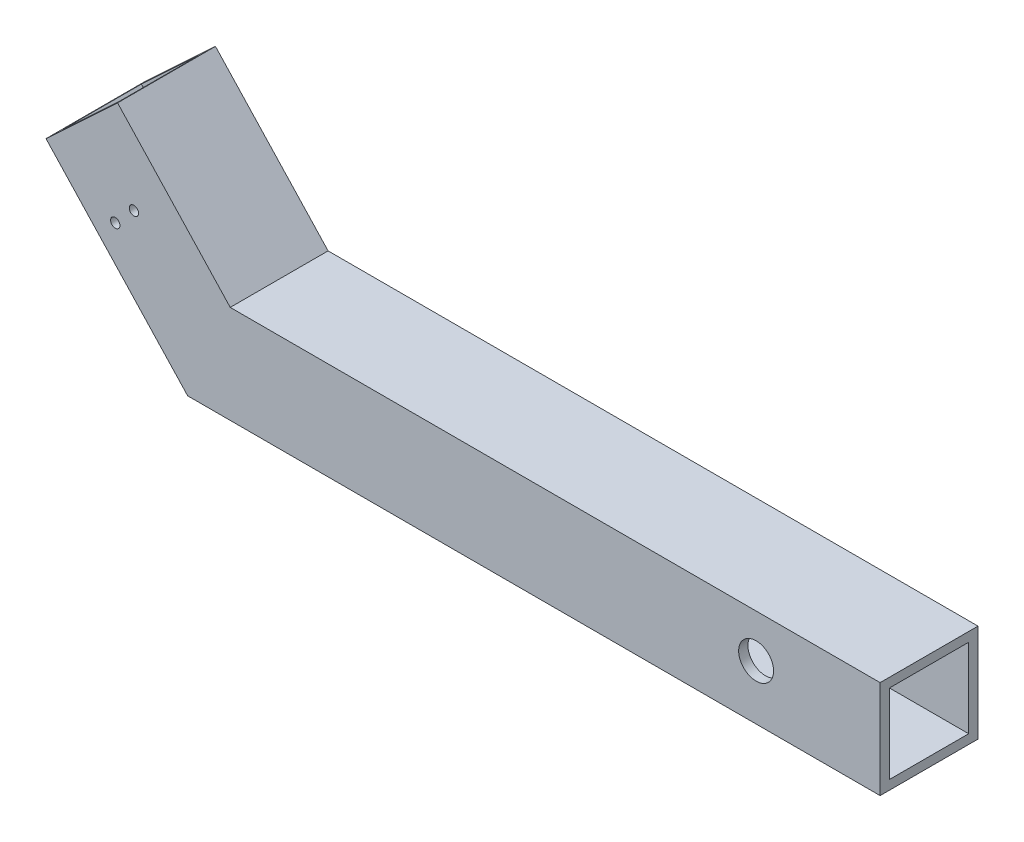
from build123d import *

# Parameters (mm, degrees)
SKETCH2_W          = 26.67
SKETCH2_H          = 26.67
SKETCH2_W_2        = 21.59
SKETCH2_H_2        = 21.59
SKETCH4_R          = 4.7625
CUT_EXTRUDE2_DEPTH = 234.463995003
SKETCH5_R          = 1.27
CUT_EXTRUDE3_DEPTH = 234.463995003


with BuildPart() as part:
    # Sweep1: sweep along a path in Sketch1
    with BuildLine(Plane.XY) as sweep1_path:
        Line((0, 0), (-171.835765676, 0))
        Line((-171.835765676, 0), (-182.88, 0))
        Line((-182.88, 0), (-190.412149697, 8.077241654))
        Line((-190.412149697, 8.077241654), (-217.525516691, 37.152768042))
    # Sketch2 → Sweep1 (sweep)
    with BuildSketch(Plane(origin=(0, 0, 0), x_dir=(0, 0, -1), z_dir=(1, 0, 0))):
        Rectangle(SKETCH2_W, SKETCH2_H)
        Rectangle(SKETCH2_W_2, SKETCH2_H_2, mode=Mode.SUBTRACT)
    sweep(path=sweep1_path.line, transition=Transition.RIGHT)

    # Sketch4 → Cut-Extrude2 (cut, through all)
    with BuildSketch(Plane.XY.offset(13.335)):
        with Locations((-33.788615372, 1.553440166)):
            Circle(SKETCH4_R)
    extrude(amount=-CUT_EXTRUDE2_DEPTH, mode=Mode.SUBTRACT)

    # Sketch5 → Cut-Extrude3 (cut, through all)
    with BuildSketch(Plane.XY.offset(13.335)):
        with Locations((-203.326149514, 23.038600359)):
            Circle(SKETCH5_R)
        with Locations((-208.411861608, 17.628386689)):
            Circle(SKETCH5_R)
    extrude(amount=-CUT_EXTRUDE3_DEPTH, mode=Mode.SUBTRACT)


solid = part.part
